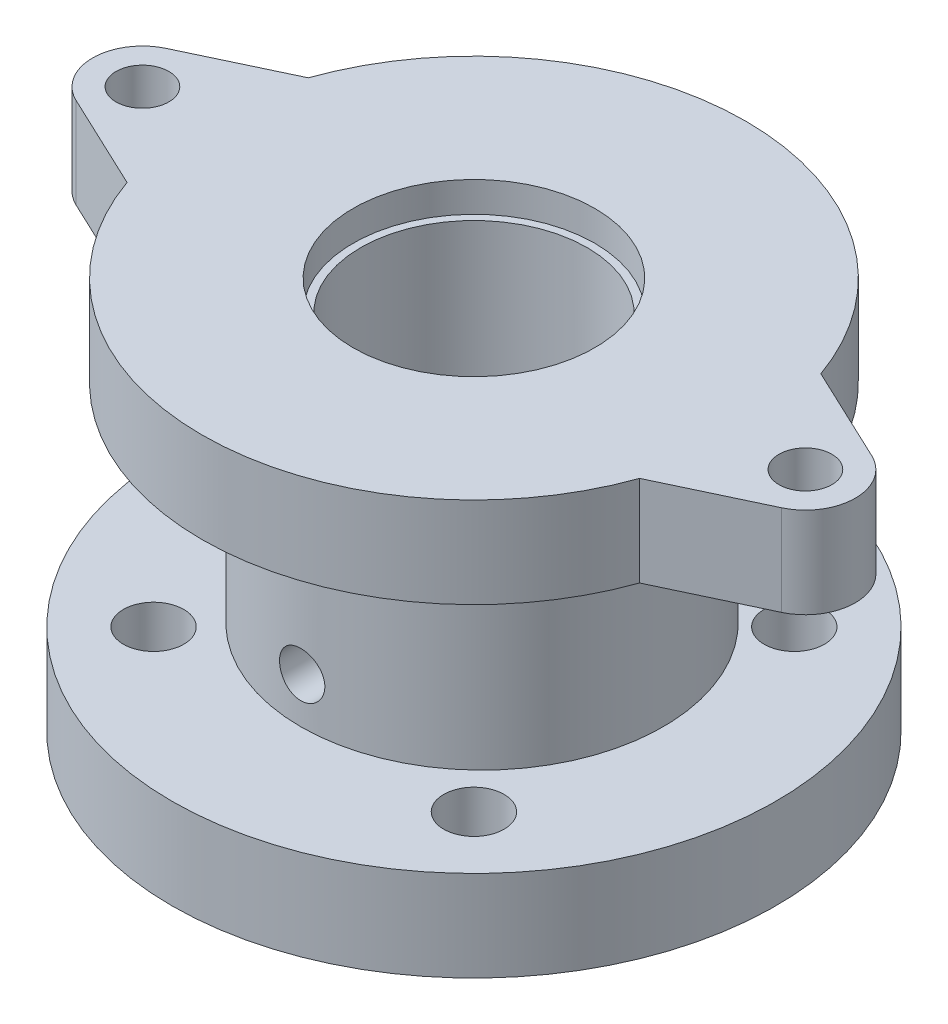
from build123d import *

# Parameters (mm, degrees)
SKETCH1_R               = 20
SKETCH1_R_2             = 7.5
BOSS_EXTRUDE1_DEPTH     = 6
SKETCH2_R               = 12
SKETCH2_R_2             = 7.5
BOSS_EXTRUDE2_DEPTH     = 14
CUT_EXTRUDE1_DEPTH      = 35.641016151
CUT_EXTRUDE1_DEPTH_BACK = 35.641016151
SKETCH3_R               = 1.5
SKETCH4_R               = 18
SKETCH4_R_2             = 7.5
BOSS_EXTRUDE3_DEPTH     = 6
BOSS_EXTRUDE4_START     = -6
SKETCH5_R               = 1.75
BOSS_EXTRUDE4_DEPTH     = 6
CUT_EXTRUDE2_DEPTH      = 42.39519906
CUT_EXTRUDE2_DEPTH_BACK = 6
SKETCH6_R               = 2
SKETCH7_R               = 8
CUT_EXTRUDE3_DEPTH      = 2


with BuildPart() as part:
    # Sketch1 → Boss-Extrude1 (new body)
    with BuildSketch(Plane(origin=(0, 0, 0), x_dir=(1, 0, 0), z_dir=(0, 1, 0))):
        with Locations(Location((0, 0, 0), (0, 0, 270))):
            Circle(SKETCH1_R)
        with Locations(Location((0, 0, 0), (0, 0, 270))):
            Circle(SKETCH1_R_2, mode=Mode.SUBTRACT)
    extrude(amount=BOSS_EXTRUDE1_DEPTH)

    # Sketch2 → Boss-Extrude2 (add)
    with BuildSketch(Plane(origin=(0, 6, 0), x_dir=(1, 0, 0), z_dir=(0, 1, 0))):
        with Locations(Location((0, 0.535416774, 0), (0, 0, 270))):
            Circle(SKETCH2_R)
        with Locations(Location((0, 0, 0), (0, 0, 270))):
            Circle(SKETCH2_R_2, mode=Mode.SUBTRACT)
    extrude(amount=BOSS_EXTRUDE2_DEPTH)

    # Sketch3 → Cut-Extrude1 (cut, two sides: drawn at the far end of the back side and taken through both)
    with BuildSketch(Plane.XY.offset(-CUT_EXTRUDE1_DEPTH_BACK)):
        with Locations((0, 9)):
            Circle(SKETCH3_R)
    extrude(amount=CUT_EXTRUDE1_DEPTH + CUT_EXTRUDE1_DEPTH_BACK, mode=Mode.SUBTRACT)

    # Sketch4 → Boss-Extrude3 (add)
    with BuildSketch(Plane(origin=(0, 20, 0), x_dir=(1, 0, 0), z_dir=(0, 1, 0))):
        with Locations(Location((0, 0, 0), (0, 0, 270))):
            Circle(SKETCH4_R)
        with Locations(Location((0, 0, 0), (0, 0, 270))):
            Circle(SKETCH4_R_2, mode=Mode.SUBTRACT)
    extrude(amount=BOSS_EXTRUDE3_DEPTH)

    # Sketch5 → Boss-Extrude4 (add)
    # profile 1 of 2: a face of its own
    with BuildSketch(Plane(origin=(0, 26, 0), x_dir=(1, 0, 0), z_dir=(0, 1, 0)).offset(BOSS_EXTRUDE4_START)):
        with BuildLine():
            Line((-23.358800107, 2.984171955), (-16.970562748, 6))
            ThreePointArc((-16.970562748, 6), (-18, 0), (-16.970562748, -6))
            Line((-16.970562748, -6), (-23.358800107, -2.984171955))
            ThreePointArc((-23.358800107, -2.984171955), (-25.25, 0), (-23.358800107, 2.984171955))
        make_face()
        with Locations(Location((-21.95, 0, 0), (0, 0, 270))):
            Circle(SKETCH5_R, mode=Mode.SUBTRACT)
    # profile 2 of 2: a face of its own
    with BuildSketch(Plane(origin=(0, 26, 0), x_dir=(1, 0, 0), z_dir=(0, 1, 0)).offset(BOSS_EXTRUDE4_START)):
        with BuildLine():
            Line((23.358800107, 2.984171955), (16.970562748, 6))
            ThreePointArc((16.970562748, 6), (18, 0), (16.970562748, -6))
            Line((16.970562748, -6), (23.358800107, -2.984171955))
            ThreePointArc((23.358800107, -2.984171955), (25.25, 0), (23.358800107, 2.984171955))
        make_face()
        with Locations(Location((21.95, 0, 0), (0, 0, 270))):
            Circle(SKETCH5_R, mode=Mode.SUBTRACT)
    extrude(amount=BOSS_EXTRUDE4_DEPTH)

    # Sketch6 → Cut-Extrude2 (cut, two sides: drawn at the far end of the back side and taken through both)
    with BuildSketch(Plane.XZ.offset(-CUT_EXTRUDE2_DEPTH_BACK)):
        with Locations(Location((-10.606601718, 10.606601718, 0), (0, 0, 270))):
            Circle(SKETCH6_R)
        with Locations(Location((10.606601718, 10.606601718, 0), (0, 0, 270))):
            Circle(SKETCH6_R)
        with Locations(Location((10.606601718, -10.606601718, 0), (0, 0, 270))):
            Circle(SKETCH6_R)
        with Locations(Location((-10.606601718, -10.606601718, 0), (0, 0, 270))):
            Circle(SKETCH6_R)
    extrude(amount=CUT_EXTRUDE2_DEPTH + CUT_EXTRUDE2_DEPTH_BACK, mode=Mode.SUBTRACT)

    # Sketch7 → Cut-Extrude3 (cut)
    with BuildSketch(Plane(origin=(0, 26, 0), x_dir=(1, 0, 0), z_dir=(0, 1, 0))):
        with Locations(Location((0, 0, 0), (0, 0, 270))):
            Circle(SKETCH7_R)
    extrude(amount=-CUT_EXTRUDE3_DEPTH, mode=Mode.SUBTRACT)


solid = part.part
